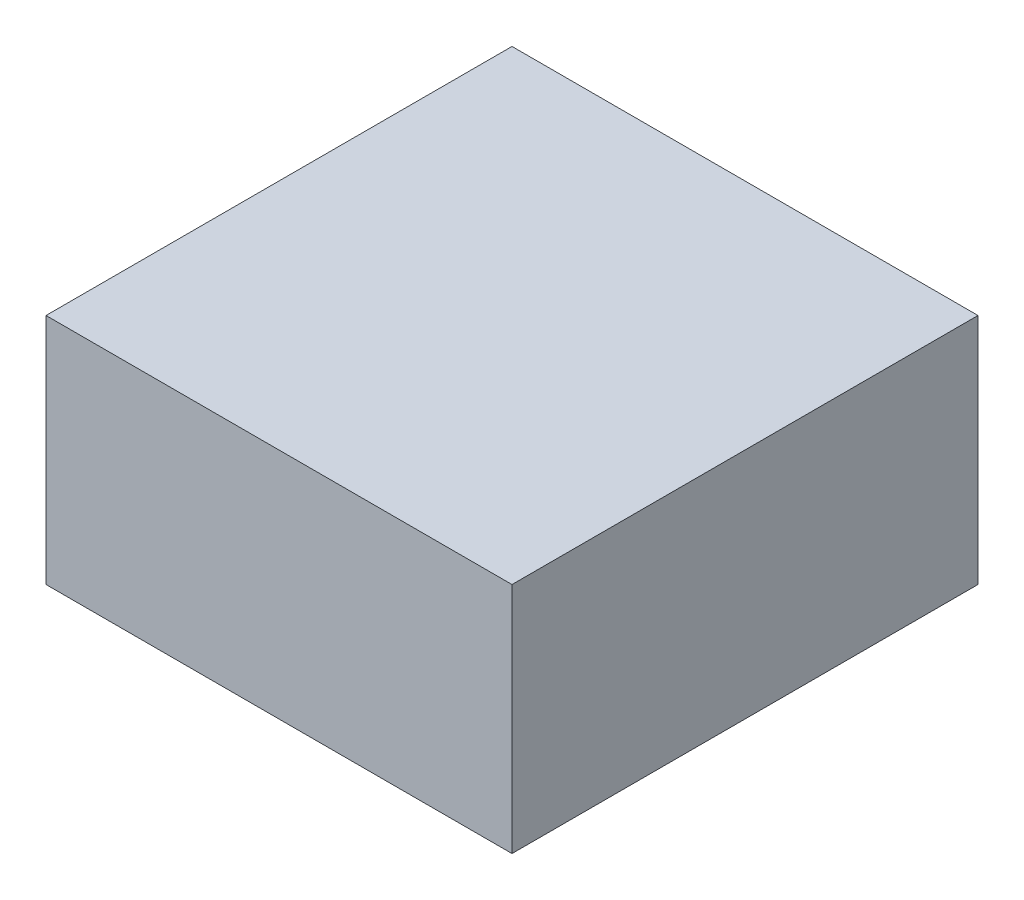
from build123d import *

# Parameters (mm, degrees)
SKETCH1_W           = 86.36
SKETCH1_H           = 86.36
BOSS_EXTRUDE1_DEPTH = 43.18
SKETCH2_W           = 81.28
SKETCH2_H           = 81.28
CUT_EXTRUDE2_DEPTH  = 35.56
SKETCH6_W           = 81.28
SKETCH6_H           = 81.28
SKETCH6_R           = 1.016
BOSS_EXTRUDE2_DEPTH = 30.48
SKETCH9_R           = 6.35
CUT_EXTRUDE3_DEPTH  = 5.08
CUT_EXTRUDE4_REACH  = 107.769
SKETCH10_R          = 1.905


with BuildPart() as part:
    # Sketch1 → Boss-Extrude1 (new body)
    with BuildSketch(Plane(origin=(0, 0, 0), x_dir=(1, 0, 0), z_dir=(0, 1, 0))):
        Rectangle(SKETCH1_W, SKETCH1_H)
    extrude(amount=-BOSS_EXTRUDE1_DEPTH)

    # Sketch2 → Cut-Extrude2 (cut)
    with BuildSketch(Plane(origin=(0, -43.18, 0), x_dir=(-1, 0, 0), z_dir=(0, -1, 0))):
        Rectangle(SKETCH2_W, SKETCH2_H)
    extrude(amount=-CUT_EXTRUDE2_DEPTH, mode=Mode.SUBTRACT)

    # Sketch6 → Boss-Extrude2 (add)
    with BuildSketch(Plane(origin=(0, -7.62, 0), x_dir=(-1, 0, 0), z_dir=(0, -1, 0))):
        Rectangle(SKETCH6_W, SKETCH6_H)
        with Locations(Location((-35.56, 35.56, 0), (0, 0, 270))):
            Circle(SKETCH6_R, mode=Mode.SUBTRACT)
        with Locations(Location((35.56, 35.56, 0), (0, 0, 270))):
            Circle(SKETCH6_R, mode=Mode.SUBTRACT)
        with Locations(Location((35.56, -35.56, 0), (0, 0, 270))):
            Circle(SKETCH6_R, mode=Mode.SUBTRACT)
        with Locations(Location((-35.56, -35.56, 0), (0, 0, 270))):
            Circle(SKETCH6_R, mode=Mode.SUBTRACT)
        with BuildLine():
            Line((-27.94, 38.1), (27.94, 38.1))
            ThreePointArc((27.94, 38.1), (29.736051224, 37.356051224), (30.48, 35.56))
            ThreePointArc((30.48, 35.56), (31.967897552, 31.967897552), (35.56, 30.48))
            ThreePointArc((35.56, 30.48), (37.356051224, 29.736051224), (38.1, 27.94))
            Line((38.1, 27.94), (38.1, -27.94))
            ThreePointArc((38.1, -27.94), (37.356051224, -29.736051224), (35.56, -30.48))
            ThreePointArc((35.56, -30.48), (31.967897552, -31.967897552), (30.48, -35.56))
            ThreePointArc((30.48, -35.56), (29.736051224, -37.356051224), (27.94, -38.1))
            Line((27.94, -38.1), (-27.94, -38.1))
            ThreePointArc((-27.94, -38.1), (-29.736051224, -37.356051224), (-30.48, -35.56))
            ThreePointArc((-30.48, -35.56), (-31.967897552, -31.967897552), (-35.56, -30.48))
            ThreePointArc((-35.56, -30.48), (-37.356051224, -29.736051224), (-38.1, -27.94))
            Line((-38.1, -27.94), (-38.1, 27.94))
            ThreePointArc((-38.1, 27.94), (-37.356051224, 29.736051224), (-35.56, 30.48))
            ThreePointArc((-35.56, 30.48), (-31.967897552, 31.967897552), (-30.48, 35.56))
            ThreePointArc((-30.48, 35.56), (-29.736051224, 37.356051224), (-27.94, 38.1))
        make_face(mode=Mode.SUBTRACT)
    extrude(amount=BOSS_EXTRUDE2_DEPTH)

    # Sketch9 → Cut-Extrude3 (cut)
    with BuildSketch(Plane.ZY.offset(43.18)):
        with Locations((0, -27.94)):
            Circle(SKETCH9_R)
        with Locations((-17.78, -18.102622301)):
            Circle(SKETCH9_R)
        with Locations((17.78, -18.102622301)):
            Circle(SKETCH9_R)
    extrude(amount=-CUT_EXTRUDE3_DEPTH, mode=Mode.SUBTRACT)

    # Sketch10 → Cut-Extrude4 (cut, up to next)
    with BuildSketch(Plane.ZY.offset(43.18), mode=Mode.PRIVATE) as cut_extrude4_sk1:
        with Locations((0, -10.16)):
            Circle(SKETCH10_R)
    cut_extrude4_tool1 = extrude(cut_extrude4_sk1.sketch, amount=-CUT_EXTRUDE4_REACH, mode=Mode.PRIVATE) & part.part
    add(cut_extrude4_tool1.solids().sort_by_distance((-43.18, -10.16, 0))[0], mode=Mode.SUBTRACT)


solid = part.part
